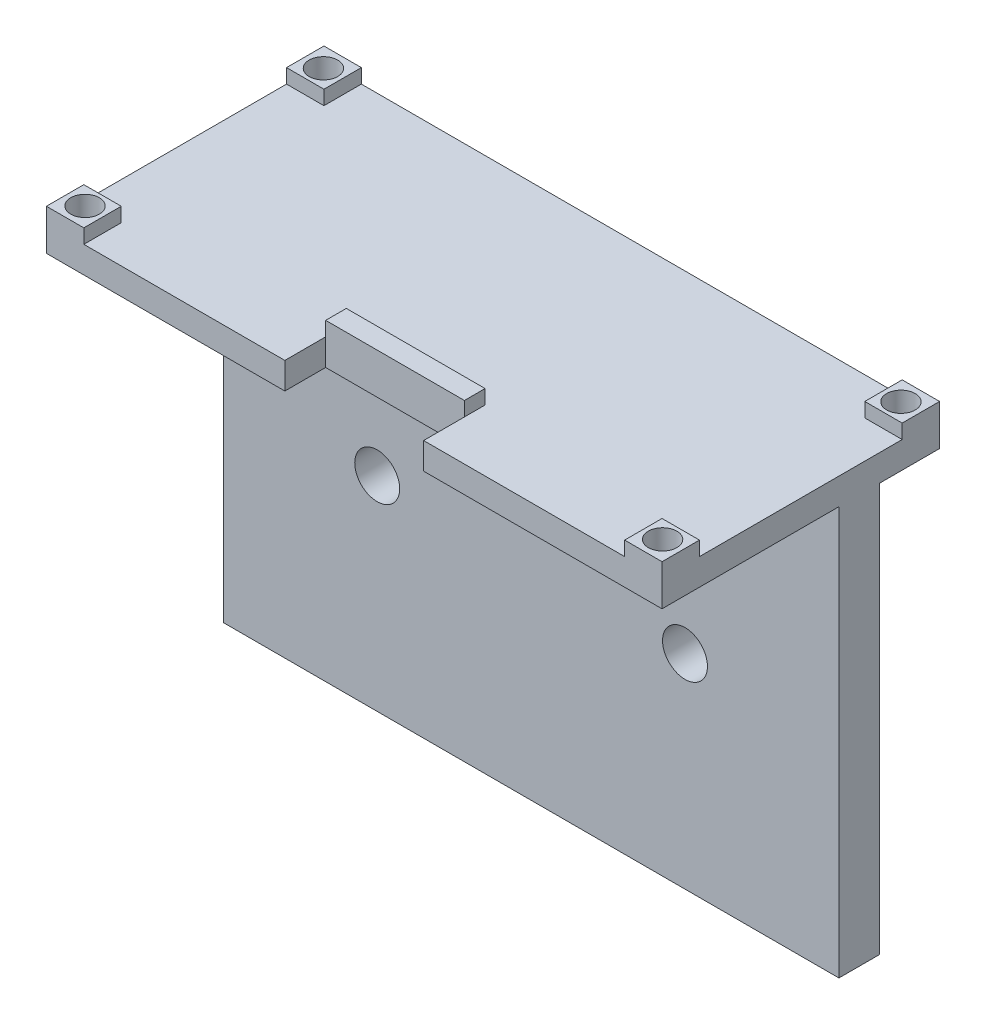
from build123d import *

# Parameters (mm, degrees)
CROQUIS1_W              = 45.25
CROQUIS1_H              = 20.4
SALIENTE_EXTRUIR1_DEPTH = 3
CROQUIS2_W              = 10.2
CROQUIS2_H              = 3
CORTAR_EXTRUIR1_DEPTH   = 50.726476851
CORTAR_EXTRUIR2_DEPTH   = 1.05
CROQUIS5_R              = 1.05
CORTAR_EXTRUIR4_DEPTH   = 50.726476851
SALIENTE_EXTRUIR2_DEPTH = 30
CROQUIS8_W              = 45.25
CROQUIS8_H              = 30
CORTAR_EXTRUIR5_DEPTH   = 10
CROQUIS10_R             = 1.65
CORTAR_EXTRUIR6_DEPTH   = 58.197574249
CROQUIS11_W             = 45.25
CROQUIS11_H             = 30
CORTAR_EXTRUIR7_DEPTH   = 2


with BuildPart() as part:
    # Croquis1 → Saliente-Extruir1 (new body)
    with BuildSketch(Plane(origin=(0, 0, 0), x_dir=(1, 0, 0), z_dir=(0, 1, 0))):
        with Locations((22.625, 10.2)):
            Rectangle(CROQUIS1_W, CROQUIS1_H)
    extrude(amount=SALIENTE_EXTRUIR1_DEPTH)

    # Croquis2 → Cortar-Extruir1 (cut, through all)
    with BuildSketch(Plane(origin=(0, 3, 0), x_dir=(1, 0, 0), z_dir=(0, 1, 0))):
        with Locations((22.625, 1.5)):
            Rectangle(CROQUIS2_W, CROQUIS2_H)
    extrude(amount=-CORTAR_EXTRUIR1_DEPTH, mode=Mode.SUBTRACT)

    # Croquis3 → Cortar-Extruir2 (cut)
    with BuildSketch(Plane(origin=(0, 3, 0), x_dir=(1, 0, 0), z_dir=(0, 1, 0))):
        Polygon((42.5, 0), (27.725, 0), (27.725, 4.51852132), (17.525, 4.51852132), (17.525, 0), (2.75, 0), (2.75, 2.75), (0, 2.75), (0, 17.65), (2.75, 17.65), (2.75, 20.4), (42.5, 20.4), (42.5, 17.65), (45.25, 17.65), (45.25, 2.75), (42.5, 2.75), align=None)
    extrude(amount=-CORTAR_EXTRUIR2_DEPTH, mode=Mode.SUBTRACT)

    # Croquis5 → Cortar-Extruir4 (cut, through all)
    with BuildSketch(Plane(origin=(0, 3, 0), x_dir=(1, 0, 0), z_dir=(0, 1, 0))):
        with Locations(Location((43.85, 18.96, 0), (0, 0, 270))):
            Circle(CROQUIS5_R)
        with Locations(Location((1.4, 18.96, 0), (0, 0, 90))):
            Circle(CROQUIS5_R)
        with Locations(Location((43.85, 1.44, 0), (0, 0, 90))):
            Circle(CROQUIS5_R)
        with Locations(Location((1.4, 1.44, 0), (0, 0, 270))):
            Circle(CROQUIS5_R)
    extrude(amount=-CORTAR_EXTRUIR4_DEPTH, mode=Mode.SUBTRACT)

    # Croquis6 → Saliente-Extruir2 (add)
    with BuildSketch(Plane.XZ):
        Polygon((17.525, -3), (0, -3), (0, -18), (45.25, -18), (45.25, -3), align=None)
    extrude(amount=SALIENTE_EXTRUIR2_DEPTH)

    # Croquis8 → Cortar-Extruir5 (cut)
    with BuildSketch(Plane.XY.offset(-3)):
        with Locations((22.625, -15)):
            Rectangle(CROQUIS8_W, CROQUIS8_H)
    extrude(amount=-CORTAR_EXTRUIR5_DEPTH, mode=Mode.SUBTRACT)

    # Croquis10 → Cortar-Extruir6 (cut, through all)
    with BuildSketch(Plane(origin=(0, 0, -18), x_dir=(-1, 0, 0), z_dir=(0, 0, -1))):
        with Locations((-11.3125, -15)):
            Circle(CROQUIS10_R)
        with Locations((-33.9375, -15)):
            Circle(CROQUIS10_R)
    extrude(amount=-CORTAR_EXTRUIR6_DEPTH, mode=Mode.SUBTRACT)

    # Croquis11 → Cortar-Extruir7 (cut)
    with BuildSketch(Plane(origin=(0, 0, -18), x_dir=(-1, 0, 0), z_dir=(0, 0, -1))):
        with Locations((-22.625, -15)):
            Rectangle(CROQUIS11_W, CROQUIS11_H)
    extrude(amount=-CORTAR_EXTRUIR7_DEPTH, mode=Mode.SUBTRACT)


solid = part.part
